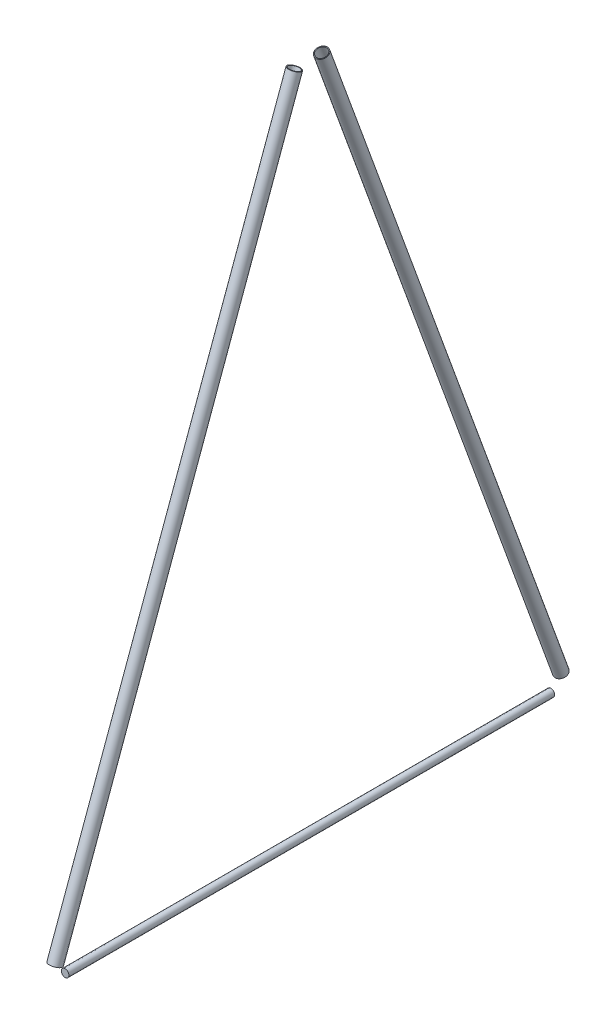
from build123d import *

# Parameters (mm, degrees)
BOSS_EXTRUDE3_DEPTH      = 730.25
BOSS_EXTRUDE3_DEPTH_BACK = 730.25
SKETCH6_R                = 12.7
SKETCH6_R_2              = 11.049
BOSS_EXTRUDE4_DEPTH      = 730.25
BOSS_EXTRUDE4_DEPTH_BACK = 730.25
SKETCH7_R                = 12.7
SKETCH7_R_2              = 11.049
BOSS_EXTRUDE6_DEPTH      = 508
BOSS_EXTRUDE6_DEPTH_BACK = 508
SKETCH10_R               = 7.9375


with BuildPart() as part:
    # Sketch6 → Boss-Extrude3 (new, two sides: drawn at the far end of the back side and taken through both)
    with BuildSketch(Plane(origin=(0, 757.180911244, -278.727658666), x_dir=(1, 0, 0), z_dir=(0, 0.9394968428050069, 0.34255756065138043)).offset(-BOSS_EXTRUDE3_DEPTH_BACK)):
        with Locations(Location((0, 0, 0), (0, 0, 270))):
            Circle(SKETCH6_R)
        with Locations(Location((0, 0, 0), (0, 0, 270))):
            Circle(SKETCH6_R_2, mode=Mode.SUBTRACT)
    extrude(amount=BOSS_EXTRUDE3_DEPTH + BOSS_EXTRUDE3_DEPTH_BACK)


with BuildPart() as body_2:
    # Sketch7 → Boss-Extrude4 (new, two sides: drawn at the far end of the back side and taken through both)
    with BuildSketch(Plane(origin=(0, 757.180911244, 278.727658666), x_dir=(-1, 0, 0), z_dir=(0, -0.939496842805007, 0.34255756065138043)).offset(-BOSS_EXTRUDE4_DEPTH_BACK)):
        with Locations(Location((0, 0, 0), (0, 0, 90))):
            Circle(SKETCH7_R)
        with Locations(Location((0, 0, 0), (0, 0, 90))):
            Circle(SKETCH7_R_2, mode=Mode.SUBTRACT)
    extrude(amount=BOSS_EXTRUDE4_DEPTH + BOSS_EXTRUDE4_DEPTH_BACK)


with BuildPart() as body_3:
    # Sketch10 → Boss-Extrude6 (new, two sides: drawn at the far end of the back side and taken through both)
    with BuildSketch(Plane.XY.offset(-BOSS_EXTRUDE6_DEPTH_BACK)):
        with Locations((0, 44.45)):
            Circle(SKETCH10_R)
    extrude(amount=BOSS_EXTRUDE6_DEPTH + BOSS_EXTRUDE6_DEPTH_BACK)


solid = Compound([part.part, body_2.part, body_3.part])
